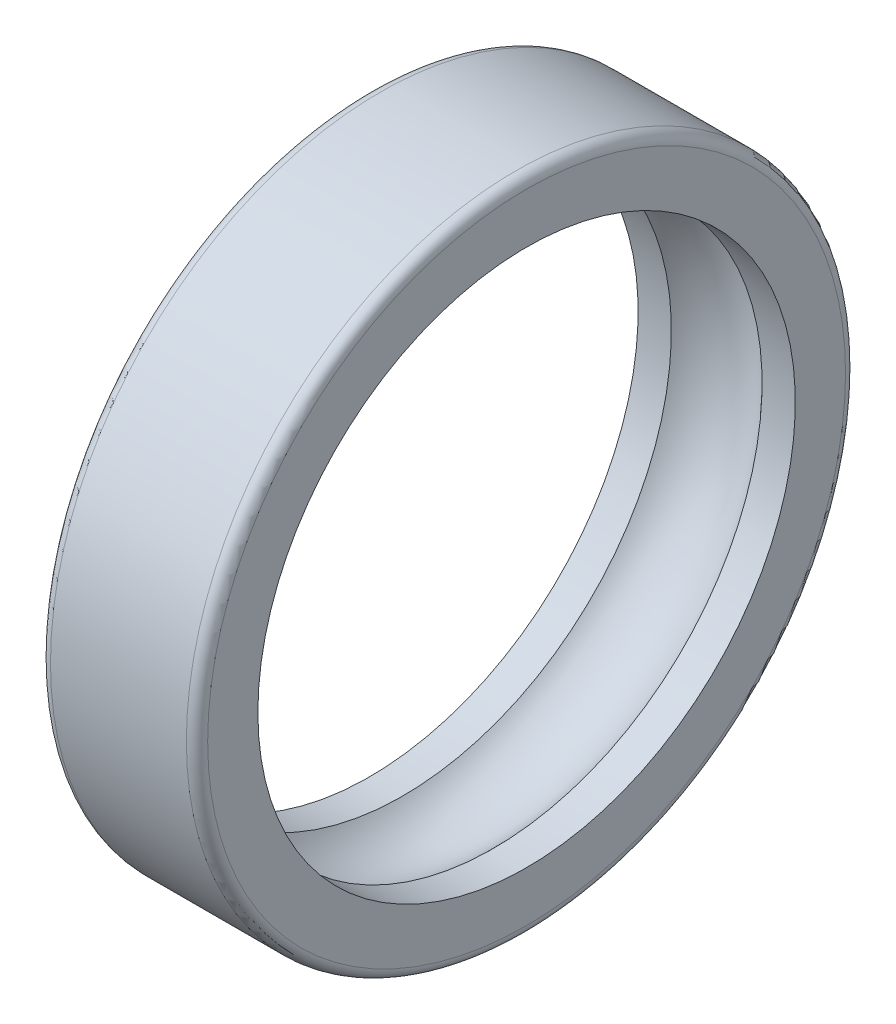
from build123d import *

# Parameters (mm, degrees)
FILLET1_R    = 2.1
SCALE1_SCALE = 0.1


with BuildPart() as part:
    # Sketch1 → Revolve1 (revolve)
    with BuildSketch(Plane.XY, mode=Mode.PRIVATE) as revolve1_sk:
        with BuildLine():
            Line((-15.5, 65), (15.5, 65))
            Line((15.5, 65), (15.5, 53))
            Line((15.5, 53), (8.94427191, 53))
            ThreePointArc((8.94427191, 53), (0, 57), (-8.94427191, 53))
            Line((-8.94427191, 53), (-15.5, 53))
            Line((-15.5, 53), (-15.5, 65))
        make_face()
    revolve(revolve1_sk.sketch.rotate(Axis((-16.576388889, 0, 0), (1, 0, 0)), 90), axis=Axis((-16.576388889, 0, 0), (1, 0, 0)))

    # Fillet1
    fillet1_edges = [part.edges().sort_by_distance(p)[0] for p in [
        (15.5, 0, -65),
        (-15.5, 0, -65),
    ]]
    fillet(fillet1_edges, radius=FILLET1_R)


with BuildPart() as part_1:
    # Scale1: scaled about (0, 0, 0)
    add(part.part.scale(SCALE1_SCALE))


solid = part_1.part
